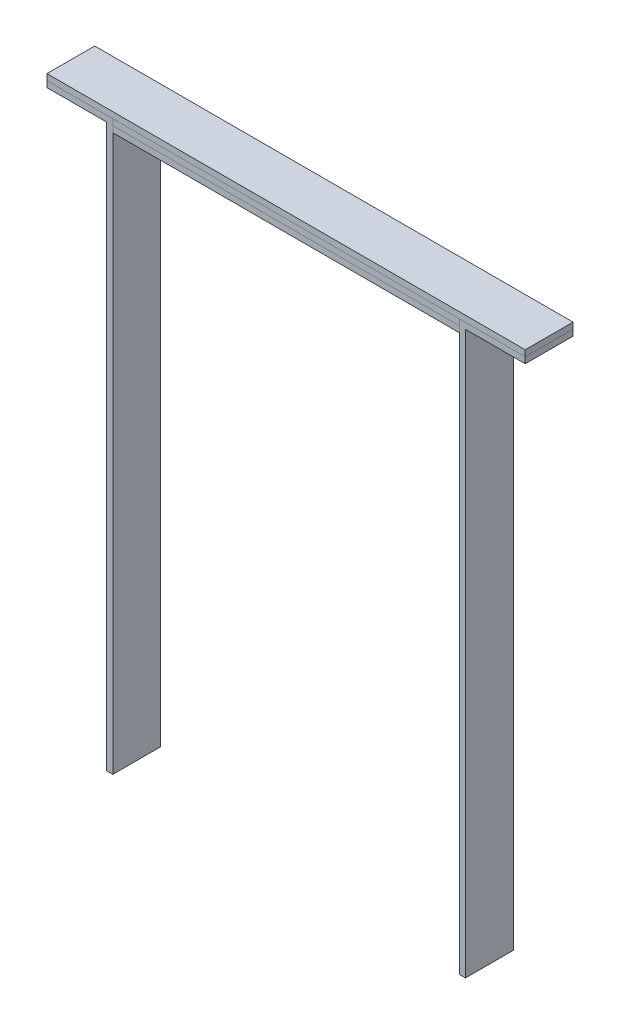
from build123d import *

# Parameters (mm, degrees)
BOSS_EXTRUDE1_DEPTH   = 10
BOSS_EXTRUDE1_2_DEPTH = 10
SKETCH2_4_W           = 72.46
SKETCH2_4_H           = 1.27
BOSS_EXTRUDE2_DEPTH   = 10
BOSS_EXTRUDE3_DEPTH   = 10
SKETCH2_7_W           = 72.46
SKETCH2_7_H           = 1.27
BOSS_EXTRUDE4_DEPTH   = 10


with BuildPart() as part:
    # Sketch2 → Boss-Extrude1 (new body)
    with BuildSketch(Plane.XY):
        Polygon((0, 117.46), (0, 0), (1.27, 0), (1.27, 118.73), (-12.5, 118.73), (-12.5, 117.46), align=None)
    extrude(amount=BOSS_EXTRUDE1_DEPTH)


with BuildPart() as body_2:
    # Sketch2 → Boss-Extrude1 2 (new body)
    with BuildSketch(Plane.XY):
        Polygon((73.73, 118.73), (73.73, 0), (75, 0), (75, 117.46), (87.5, 117.46), (87.5, 118.73), align=None)
    extrude(amount=BOSS_EXTRUDE1_2_DEPTH)


with BuildPart() as body_3:
    # Sketch2<4> → Boss-Extrude2 (new body)
    with BuildSketch(Plane.XY):
        with Locations((37.5, 118.095)):
            Rectangle(SKETCH2_4_W, SKETCH2_4_H)
    extrude(amount=BOSS_EXTRUDE2_DEPTH)


with BuildPart() as body_4:
    # Sketch2<5> → Boss-Extrude3 (new body)
    with BuildSketch(Plane.XY):
        Polygon((-12.5, 120), (-12.5, 118.73), (1.27, 118.73), (73.73, 118.73), (87.5, 118.73), (87.5, 120), align=None)
    extrude(amount=BOSS_EXTRUDE3_DEPTH)


with BuildPart() as body_5:
    # Sketch2<7> → Boss-Extrude4 (new body)
    with BuildSketch(Plane.XY):
        with Locations((37.5, 116.825)):
            Rectangle(SKETCH2_7_W, SKETCH2_7_H)
    extrude(amount=BOSS_EXTRUDE4_DEPTH)


solid = Compound([part.part, body_2.part, body_3.part, body_4.part, body_5.part])
